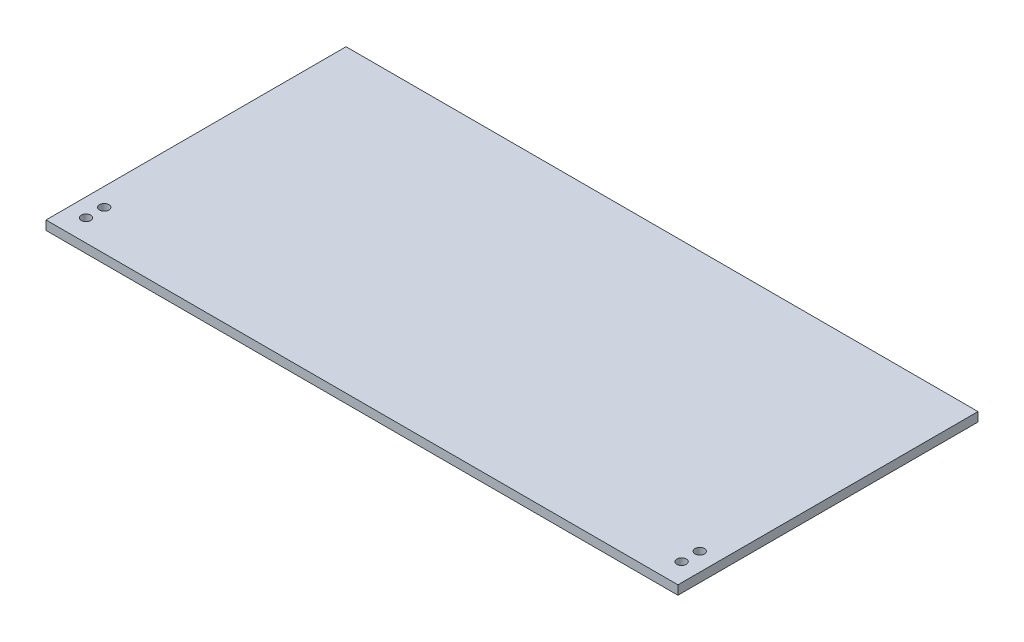
from build123d import *

# Parameters (mm, degrees)
SKETCH_1_W      = 347.5
SKETCH_1_H      = 165
SKETCH_1_R      = 2.6
EXTRUDE_1_DEPTH = 5


with BuildPart() as part:
    # 草图1 → 凸台-拉伸1 (new body)
    with BuildSketch(Plane(origin=(0, 5, 0), x_dir=(1, 0, 0), z_dir=(0, 1, 0))):
        Rectangle(SKETCH_1_W, SKETCH_1_H)
        with Locations(Location((-163.75, -70.5, 0), (0, 0, 90))):
            Circle(SKETCH_1_R, mode=Mode.SUBTRACT)
        with Locations(Location((-163.75, -60.5, 0), (0, 0, 90))):
            Circle(SKETCH_1_R, mode=Mode.SUBTRACT)
        with Locations(Location((163.75, -60.5, 0), (0, 0, 90))):
            Circle(SKETCH_1_R, mode=Mode.SUBTRACT)
        with Locations(Location((163.75, -70.5, 0), (0, 0, 90))):
            Circle(SKETCH_1_R, mode=Mode.SUBTRACT)
    extrude(amount=-EXTRUDE_1_DEPTH)


solid = part.part
